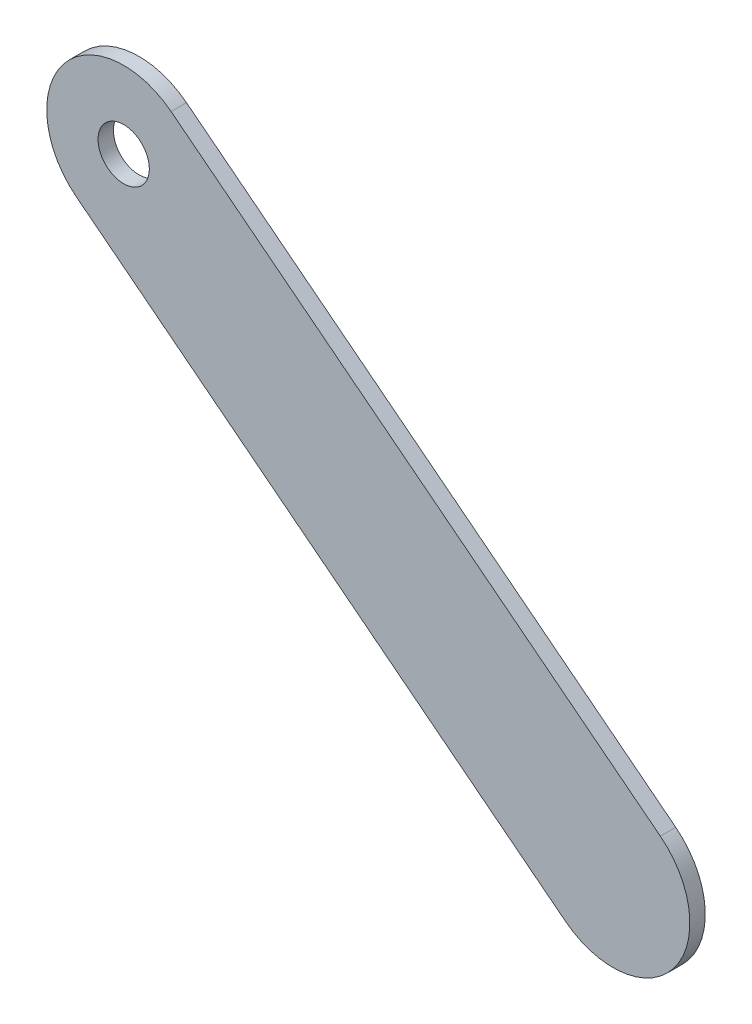
from build123d import *

# Parameters (mm, degrees)
SKETCH1_R           = 5
BOSS_EXTRUDE1_DEPTH = 1.5


with BuildPart() as part:
    # Sketch1 → Boss-Extrude1 (new, symmetric)
    with BuildSketch(Plane.XY):
        with BuildLine():
            Line((-86.14130577, 86.468523976), (9.245091692, 11.812208921))
            ThreePointArc((9.245091692, 11.812208921), (11.812208921, -9.245091692), (-9.245091692, -11.812208921))
            Line((-9.245091692, -11.812208921), (-104.631489155, 62.844106133))
            ThreePointArc((-104.631489155, 62.844106133), (-107.198606384, 83.901406746), (-86.14130577, 86.468523976))
        make_face()
        with Locations((-95.386397462, 74.656315054)):
            Circle(SKETCH1_R, mode=Mode.SUBTRACT)
    extrude(amount=BOSS_EXTRUDE1_DEPTH, both=True)


solid = part.part
